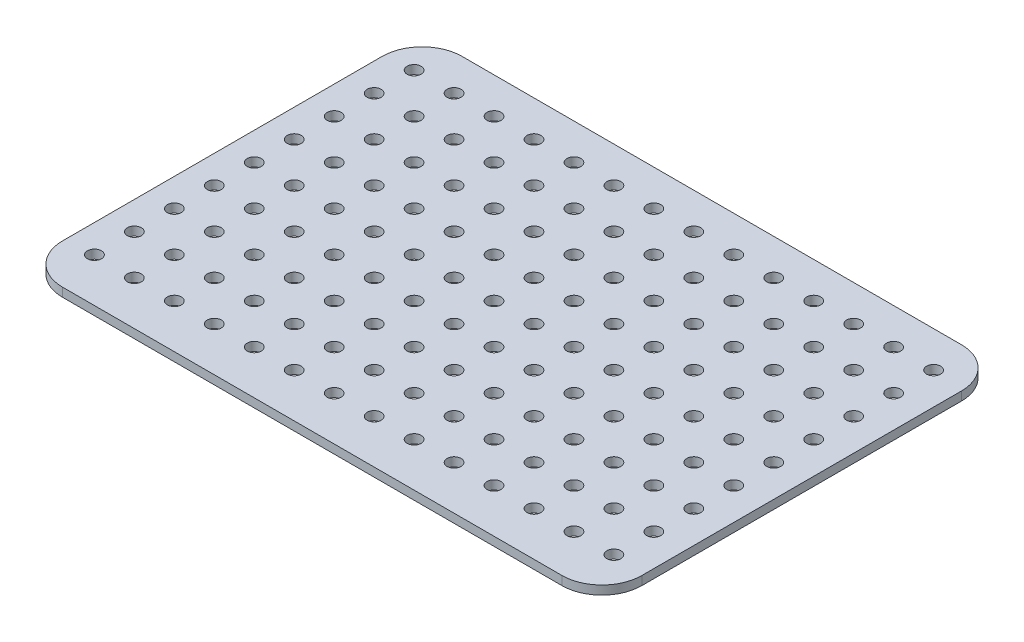
from build123d import *

# Parameters (mm, degrees)
SKETCH_1_W          = 145
SKETCH_1_H          = 100
EXTRUDE_1_DEPTH     = 2.2
SKETCH_2_R          = 1.75
CUT_EXTRUDE_1_DEPTH = 2.5
FILLET_1_R          = 10


with BuildPart() as part:
    # 草图1 → 凸台-拉伸1 (new body)
    with BuildSketch(Plane(origin=(0, 0, 0), x_dir=(1, 0, 0), z_dir=(0, 1, 0))):
        Rectangle(SKETCH_1_W, SKETCH_1_H)
    extrude(amount=EXTRUDE_1_DEPTH)

    # 草图2 → 切除-拉伸1 (cut)
    with BuildSketch(Plane(origin=(0, 2.2, 0), x_dir=(1, 0, 0), z_dir=(0, 1, 0))):
        with Locations(Location((-65.5, 41, 0), (0, 0, 270))):
            Circle(SKETCH_2_R)
        with Locations(Location((-55.5, 41, 0), (0, 0, 270))):
            Circle(SKETCH_2_R)
        with Locations(Location((-45.5, 41, 0), (0, 0, 270))):
            Circle(SKETCH_2_R)
        with Locations(Location((-35.5, 41, 0), (0, 0, 270))):
            Circle(SKETCH_2_R)
        with Locations(Location((-25.5, 41, 0), (0, 0, 270))):
            Circle(SKETCH_2_R)
        with Locations(Location((-15.5, 41, 0), (0, 0, 270))):
            Circle(SKETCH_2_R)
        with Locations(Location((-5.5, 41, 0), (0, 0, 270))):
            Circle(SKETCH_2_R)
        with Locations(Location((4.5, 41, 0), (0, 0, 270))):
            Circle(SKETCH_2_R)
        with Locations(Location((14.5, 41, 0), (0, 0, 270))):
            Circle(SKETCH_2_R)
        with Locations(Location((24.5, 41, 0), (0, 0, 270))):
            Circle(SKETCH_2_R)
        with Locations(Location((34.5, 41, 0), (0, 0, 270))):
            Circle(SKETCH_2_R)
        with Locations(Location((44.5, 41, 0), (0, 0, 270))):
            Circle(SKETCH_2_R)
        with Locations(Location((54.5, 41, 0), (0, 0, 270))):
            Circle(SKETCH_2_R)
        with Locations(Location((64.5, 41, 0), (0, 0, 270))):
            Circle(SKETCH_2_R)
        with Locations(Location((-55.5, 31, 0), (0, 0, 270))):
            Circle(SKETCH_2_R)
        with Locations(Location((-45.5, 31, 0), (0, 0, 270))):
            Circle(SKETCH_2_R)
        with Locations(Location((-35.5, 31, 0), (0, 0, 270))):
            Circle(SKETCH_2_R)
        with Locations(Location((-25.5, 31, 0), (0, 0, 270))):
            Circle(SKETCH_2_R)
        with Locations(Location((-15.5, 31, 0), (0, 0, 270))):
            Circle(SKETCH_2_R)
        with Locations(Location((-5.5, 31, 0), (0, 0, 270))):
            Circle(SKETCH_2_R)
        with Locations(Location((4.5, 31, 0), (0, 0, 270))):
            Circle(SKETCH_2_R)
        with Locations(Location((14.5, 31, 0), (0, 0, 270))):
            Circle(SKETCH_2_R)
        with Locations(Location((24.5, 31, 0), (0, 0, 270))):
            Circle(SKETCH_2_R)
        with Locations(Location((34.5, 31, 0), (0, 0, 270))):
            Circle(SKETCH_2_R)
        with Locations(Location((44.5, 31, 0), (0, 0, 270))):
            Circle(SKETCH_2_R)
        with Locations(Location((54.5, 31, 0), (0, 0, 270))):
            Circle(SKETCH_2_R)
        with Locations(Location((64.5, 31, 0), (0, 0, 270))):
            Circle(SKETCH_2_R)
        with Locations(Location((-55.5, 21, 0), (0, 0, 270))):
            Circle(SKETCH_2_R)
        with Locations(Location((-45.5, 21, 0), (0, 0, 270))):
            Circle(SKETCH_2_R)
        with Locations(Location((-35.5, 21, 0), (0, 0, 270))):
            Circle(SKETCH_2_R)
        with Locations(Location((-25.5, 21, 0), (0, 0, 270))):
            Circle(SKETCH_2_R)
        with Locations(Location((-15.5, 21, 0), (0, 0, 270))):
            Circle(SKETCH_2_R)
        with Locations(Location((-5.5, 21, 0), (0, 0, 270))):
            Circle(SKETCH_2_R)
        with Locations(Location((4.5, 21, 0), (0, 0, 270))):
            Circle(SKETCH_2_R)
        with Locations(Location((14.5, 21, 0), (0, 0, 270))):
            Circle(SKETCH_2_R)
        with Locations(Location((24.5, 21, 0), (0, 0, 270))):
            Circle(SKETCH_2_R)
        with Locations(Location((34.5, 21, 0), (0, 0, 270))):
            Circle(SKETCH_2_R)
        with Locations(Location((44.5, 21, 0), (0, 0, 270))):
            Circle(SKETCH_2_R)
        with Locations(Location((54.5, 21, 0), (0, 0, 270))):
            Circle(SKETCH_2_R)
        with Locations(Location((64.5, 21, 0), (0, 0, 270))):
            Circle(SKETCH_2_R)
        with Locations(Location((-55.5, 11, 0), (0, 0, 270))):
            Circle(SKETCH_2_R)
        with Locations(Location((-45.5, 11, 0), (0, 0, 270))):
            Circle(SKETCH_2_R)
        with Locations(Location((-35.5, 11, 0), (0, 0, 270))):
            Circle(SKETCH_2_R)
        with Locations(Location((-25.5, 11, 0), (0, 0, 270))):
            Circle(SKETCH_2_R)
        with Locations(Location((-15.5, 11, 0), (0, 0, 270))):
            Circle(SKETCH_2_R)
        with Locations(Location((-5.5, 11, 0), (0, 0, 270))):
            Circle(SKETCH_2_R)
        with Locations(Location((4.5, 11, 0), (0, 0, 270))):
            Circle(SKETCH_2_R)
        with Locations(Location((14.5, 11, 0), (0, 0, 270))):
            Circle(SKETCH_2_R)
        with Locations(Location((24.5, 11, 0), (0, 0, 270))):
            Circle(SKETCH_2_R)
        with Locations(Location((34.5, 11, 0), (0, 0, 270))):
            Circle(SKETCH_2_R)
        with Locations(Location((44.5, 11, 0), (0, 0, 270))):
            Circle(SKETCH_2_R)
        with Locations(Location((54.5, 11, 0), (0, 0, 270))):
            Circle(SKETCH_2_R)
        with Locations(Location((64.5, 11, 0), (0, 0, 270))):
            Circle(SKETCH_2_R)
        with Locations(Location((-55.5, 1, 0), (0, 0, 270))):
            Circle(SKETCH_2_R)
        with Locations(Location((-45.5, 1, 0), (0, 0, 270))):
            Circle(SKETCH_2_R)
        with Locations(Location((-35.5, 1, 0), (0, 0, 270))):
            Circle(SKETCH_2_R)
        with Locations(Location((-25.5, 1, 0), (0, 0, 270))):
            Circle(SKETCH_2_R)
        with Locations(Location((-15.5, 1, 0), (0, 0, 270))):
            Circle(SKETCH_2_R)
        with Locations(Location((-5.5, 1, 0), (0, 0, 270))):
            Circle(SKETCH_2_R)
        with Locations(Location((4.5, 1, 0), (0, 0, 270))):
            Circle(SKETCH_2_R)
        with Locations(Location((14.5, 1, 0), (0, 0, 270))):
            Circle(SKETCH_2_R)
        with Locations(Location((24.5, 1, 0), (0, 0, 270))):
            Circle(SKETCH_2_R)
        with Locations(Location((34.5, 1, 0), (0, 0, 270))):
            Circle(SKETCH_2_R)
        with Locations(Location((44.5, 1, 0), (0, 0, 270))):
            Circle(SKETCH_2_R)
        with Locations(Location((54.5, 1, 0), (0, 0, 270))):
            Circle(SKETCH_2_R)
        with Locations(Location((64.5, 1, 0), (0, 0, 270))):
            Circle(SKETCH_2_R)
        with Locations(Location((-55.5, -9, 0), (0, 0, 270))):
            Circle(SKETCH_2_R)
        with Locations(Location((-45.5, -9, 0), (0, 0, 270))):
            Circle(SKETCH_2_R)
        with Locations(Location((-35.5, -9, 0), (0, 0, 270))):
            Circle(SKETCH_2_R)
        with Locations(Location((-25.5, -9, 0), (0, 0, 270))):
            Circle(SKETCH_2_R)
        with Locations(Location((-15.5, -9, 0), (0, 0, 270))):
            Circle(SKETCH_2_R)
        with Locations(Location((-5.5, -9, 0), (0, 0, 270))):
            Circle(SKETCH_2_R)
        with Locations(Location((4.5, -9, 0), (0, 0, 270))):
            Circle(SKETCH_2_R)
        with Locations(Location((14.5, -9, 0), (0, 0, 270))):
            Circle(SKETCH_2_R)
        with Locations(Location((24.5, -9, 0), (0, 0, 270))):
            Circle(SKETCH_2_R)
        with Locations(Location((34.5, -9, 0), (0, 0, 270))):
            Circle(SKETCH_2_R)
        with Locations(Location((44.5, -9, 0), (0, 0, 270))):
            Circle(SKETCH_2_R)
        with Locations(Location((54.5, -9, 0), (0, 0, 270))):
            Circle(SKETCH_2_R)
        with Locations(Location((64.5, -9, 0), (0, 0, 270))):
            Circle(SKETCH_2_R)
        with Locations(Location((-55.5, -19, 0), (0, 0, 270))):
            Circle(SKETCH_2_R)
        with Locations(Location((-45.5, -19, 0), (0, 0, 270))):
            Circle(SKETCH_2_R)
        with Locations(Location((-35.5, -19, 0), (0, 0, 270))):
            Circle(SKETCH_2_R)
        with Locations(Location((-25.5, -19, 0), (0, 0, 270))):
            Circle(SKETCH_2_R)
        with Locations(Location((-15.5, -19, 0), (0, 0, 270))):
            Circle(SKETCH_2_R)
        with Locations(Location((-5.5, -19, 0), (0, 0, 270))):
            Circle(SKETCH_2_R)
        with Locations(Location((4.5, -19, 0), (0, 0, 270))):
            Circle(SKETCH_2_R)
        with Locations(Location((14.5, -19, 0), (0, 0, 270))):
            Circle(SKETCH_2_R)
        with Locations(Location((24.5, -19, 0), (0, 0, 270))):
            Circle(SKETCH_2_R)
        with Locations(Location((34.5, -19, 0), (0, 0, 270))):
            Circle(SKETCH_2_R)
        with Locations(Location((44.5, -19, 0), (0, 0, 270))):
            Circle(SKETCH_2_R)
        with Locations(Location((54.5, -19, 0), (0, 0, 270))):
            Circle(SKETCH_2_R)
        with Locations(Location((64.5, -19, 0), (0, 0, 270))):
            Circle(SKETCH_2_R)
        with Locations(Location((-55.5, -29, 0), (0, 0, 270))):
            Circle(SKETCH_2_R)
        with Locations(Location((-45.5, -29, 0), (0, 0, 270))):
            Circle(SKETCH_2_R)
        with Locations(Location((-35.5, -29, 0), (0, 0, 270))):
            Circle(SKETCH_2_R)
        with Locations(Location((-25.5, -29, 0), (0, 0, 270))):
            Circle(SKETCH_2_R)
        with Locations(Location((-15.5, -29, 0), (0, 0, 270))):
            Circle(SKETCH_2_R)
        with Locations(Location((-5.5, -29, 0), (0, 0, 270))):
            Circle(SKETCH_2_R)
        with Locations(Location((4.5, -29, 0), (0, 0, 270))):
            Circle(SKETCH_2_R)
        with Locations(Location((14.5, -29, 0), (0, 0, 270))):
            Circle(SKETCH_2_R)
        with Locations(Location((24.5, -29, 0), (0, 0, 270))):
            Circle(SKETCH_2_R)
        with Locations(Location((34.5, -29, 0), (0, 0, 270))):
            Circle(SKETCH_2_R)
        with Locations(Location((44.5, -29, 0), (0, 0, 270))):
            Circle(SKETCH_2_R)
        with Locations(Location((54.5, -29, 0), (0, 0, 270))):
            Circle(SKETCH_2_R)
        with Locations(Location((64.5, -29, 0), (0, 0, 270))):
            Circle(SKETCH_2_R)
        with Locations(Location((-55.5, -39, 0), (0, 0, 270))):
            Circle(SKETCH_2_R)
        with Locations(Location((-45.5, -39, 0), (0, 0, 270))):
            Circle(SKETCH_2_R)
        with Locations(Location((-35.5, -39, 0), (0, 0, 270))):
            Circle(SKETCH_2_R)
        with Locations(Location((-25.5, -39, 0), (0, 0, 270))):
            Circle(SKETCH_2_R)
        with Locations(Location((-15.5, -39, 0), (0, 0, 270))):
            Circle(SKETCH_2_R)
        with Locations(Location((-5.5, -39, 0), (0, 0, 270))):
            Circle(SKETCH_2_R)
        with Locations(Location((4.5, -39, 0), (0, 0, 270))):
            Circle(SKETCH_2_R)
        with Locations(Location((14.5, -39, 0), (0, 0, 270))):
            Circle(SKETCH_2_R)
        with Locations(Location((24.5, -39, 0), (0, 0, 270))):
            Circle(SKETCH_2_R)
        with Locations(Location((34.5, -39, 0), (0, 0, 270))):
            Circle(SKETCH_2_R)
        with Locations(Location((44.5, -39, 0), (0, 0, 270))):
            Circle(SKETCH_2_R)
        with Locations(Location((54.5, -39, 0), (0, 0, 270))):
            Circle(SKETCH_2_R)
        with Locations(Location((64.5, -39, 0), (0, 0, 270))):
            Circle(SKETCH_2_R)
        with Locations(Location((-65.5, 31, 0), (0, 0, 270))):
            Circle(SKETCH_2_R)
        with Locations(Location((-65.5, 21, 0), (0, 0, 270))):
            Circle(SKETCH_2_R)
        with Locations(Location((-65.5, 11, 0), (0, 0, 270))):
            Circle(SKETCH_2_R)
        with Locations(Location((-65.5, 1, 0), (0, 0, 270))):
            Circle(SKETCH_2_R)
        with Locations(Location((-65.5, -9, 0), (0, 0, 270))):
            Circle(SKETCH_2_R)
        with Locations(Location((-65.5, -19, 0), (0, 0, 270))):
            Circle(SKETCH_2_R)
        with Locations(Location((-65.5, -29, 0), (0, 0, 270))):
            Circle(SKETCH_2_R)
        with Locations(Location((-65.5, -39, 0), (0, 0, 270))):
            Circle(SKETCH_2_R)
    extrude(amount=-CUT_EXTRUDE_1_DEPTH, mode=Mode.SUBTRACT)

    # 圆角1
    fillet_1_edges = [part.edges().sort_by_distance(p)[0] for p in [
        (72.5, 1.1, 50),
        (-72.5, 1.1, 50),
        (-72.5, 1.1, -50),
        (72.5, 1.1, -50),
    ]]
    fillet(fillet_1_edges, radius=FILLET_1_R)


solid = part.part
